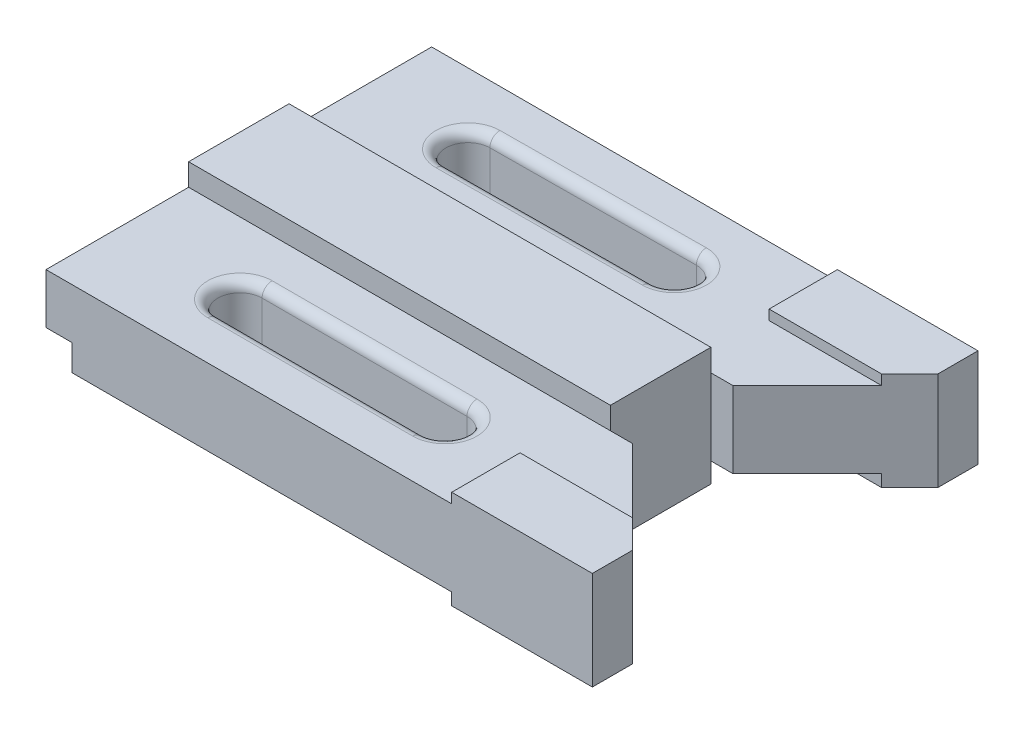
from build123d import *

# Parameters (mm, degrees)
SKETCH1_W                = 105
SKETCH1_H                = 25
BOSS_EXTRUDE4_DEPTH      = 19
BOSS_EXTRUDE5_DEPTH      = 5.5
BOSS_EXTRUDE5_DEPTH_BACK = 24
SKETCH4_W                = 105
SKETCH4_H                = 12.5
FILLET3_R                = 2.5
BOSS_EXTRUDE7_DEPTH      = 2.5
BOSS_EXTRUDE7_DEPTH_BACK = 22
SKETCH7_W                = 6.5
SKETCH7_H                = 11.5
CUT_EXTRUDE1_DEPTH       = 96


with BuildPart() as part:
    # Sketch1 → Boss-Extrude4 (new body)
    # profile 1 of 5: a face of its own
    with BuildSketch(Plane(origin=(0, 0, 0), x_dir=(1, 0, 0), z_dir=(0, 1, 0))):
        Polygon((136, 0), (94, 0), (94, -17), (129, -17), (136, -10), align=None)
    # profile 2 of 5: a face of its own
    with BuildSketch(Plane(origin=(0, 0, 0), x_dir=(1, 0, 0), z_dir=(0, 1, 0))):
        Polygon((94, 0), (0, 0), (0, -35.5), (105, -35.5), (110.5, -35.5), (129, -17), (94, -17), align=None)
        with BuildLine():
            ThreePointArc((26.584181208, -22.999838941), (21.042251663, -17.542090604), (26.5, -12.000161059))
            Line((26.5, -12.000161059), (77.5, -11.609854936))
            ThreePointArc((77.5, -11.609854936), (83.041929546, -17.067603273), (77.584181208, -22.609532819))
            Line((77.584181208, -22.609532819), (26.584181208, -22.999838941))
        make_face(mode=Mode.SUBTRACT)
    # profile 3 of 5: a face of its own
    with BuildSketch(Plane(origin=(0, 0, 0), x_dir=(1, 0, 0), z_dir=(0, 1, 0))):
        with Locations((52.5, -48)):
            Rectangle(SKETCH1_W, SKETCH1_H)
    # profile 4 of 5: a face of its own
    with BuildSketch(Plane(origin=(0, 0, 0), x_dir=(1, 0, 0), z_dir=(0, 1, 0))):
        Polygon((105, -60.5), (0, -60.5), (0, -96), (94, -96), (94, -79), (129, -79), (110.5, -60.5), align=None)
        with BuildLine():
            ThreePointArc((30.542090604, -83.75), (25.042090604, -78.25), (30.542090604, -72.75))
            Line((30.542090604, -72.75), (81.542090604, -72.75))
            ThreePointArc((81.542090604, -72.75), (87.042090604, -78.25), (81.542090604, -83.75))
            Line((81.542090604, -83.75), (30.542090604, -83.75))
        make_face(mode=Mode.SUBTRACT)
    # profile 5 of 5: a face of its own
    with BuildSketch(Plane(origin=(0, 0, 0), x_dir=(1, 0, 0), z_dir=(0, 1, 0))):
        Polygon((94, -79), (94, -96), (136, -96), (136, -86), (129, -79), align=None)
    extrude(amount=BOSS_EXTRUDE4_DEPTH)

    # Sketch4 → Boss-Extrude5 (add, two sides: drawn at the far end of the back side and taken through both)
    with BuildSketch(Plane(origin=(0, 19, 0), x_dir=(1, 0, 0), z_dir=(0, 1, 0)).offset(-BOSS_EXTRUDE5_DEPTH_BACK)):
        with Locations((52.5, -41.75)):
            Rectangle(SKETCH4_W, SKETCH4_H)
        with Locations((52.5, -54.25)):
            Rectangle(SKETCH4_W, SKETCH4_H)
    extrude(amount=BOSS_EXTRUDE5_DEPTH + BOSS_EXTRUDE5_DEPTH_BACK)

    # Fillet3
    fillet3_edges = [part.edges().sort_by_distance(p)[0] for p in [
        (56.042090604, 19, 72.75),
        (56.042090604, 0, 72.75),
        (25.042090604, 0, 78.25),
        (56.042090604, 0, 83.75),
        (87.042090604, 0, 78.25),
        (52, 0, 11.805007997),
        (21.042251663, 0, 17.542090604),
        (52.084181208, 0, 22.80468588),
        (83.041929546, 0, 17.067603273),
        (83.041929546, 19, 17.067603273),
        (52.084181208, 19, 22.80468588),
        (21.042251663, 19, 17.542090604),
        (52, 19, 11.805007997),
        (87.042090604, 19, 78.25),
        (56.042090604, 19, 83.75),
        (25.042090604, 19, 78.25),
    ]]
    fillet(fillet3_edges, radius=FILLET3_R)

    # Sketch5 → Boss-Extrude7 (add, two sides: drawn at the far end of the back side and taken through both)
    with BuildSketch(Plane(origin=(0, 19, 0), x_dir=(1, 0, 0), z_dir=(0, 1, 0)).offset(-BOSS_EXTRUDE7_DEPTH_BACK)):
        Polygon((101, 0), (101, -17), (129, -17), (136, -10), (136, 0), align=None)
        Polygon((136, -86), (129, -79), (101, -79), (101, -96), (136, -96), align=None)
    extrude(amount=BOSS_EXTRUDE7_DEPTH + BOSS_EXTRUDE7_DEPTH_BACK)

    # Sketch7 → Cut-Extrude1 (cut)
    with BuildSketch(Plane.XY.offset(96)):
        with Locations((3.25, 0.75)):
            Rectangle(SKETCH7_W, SKETCH7_H)
    extrude(amount=-CUT_EXTRUDE1_DEPTH, mode=Mode.SUBTRACT)


solid = part.part
